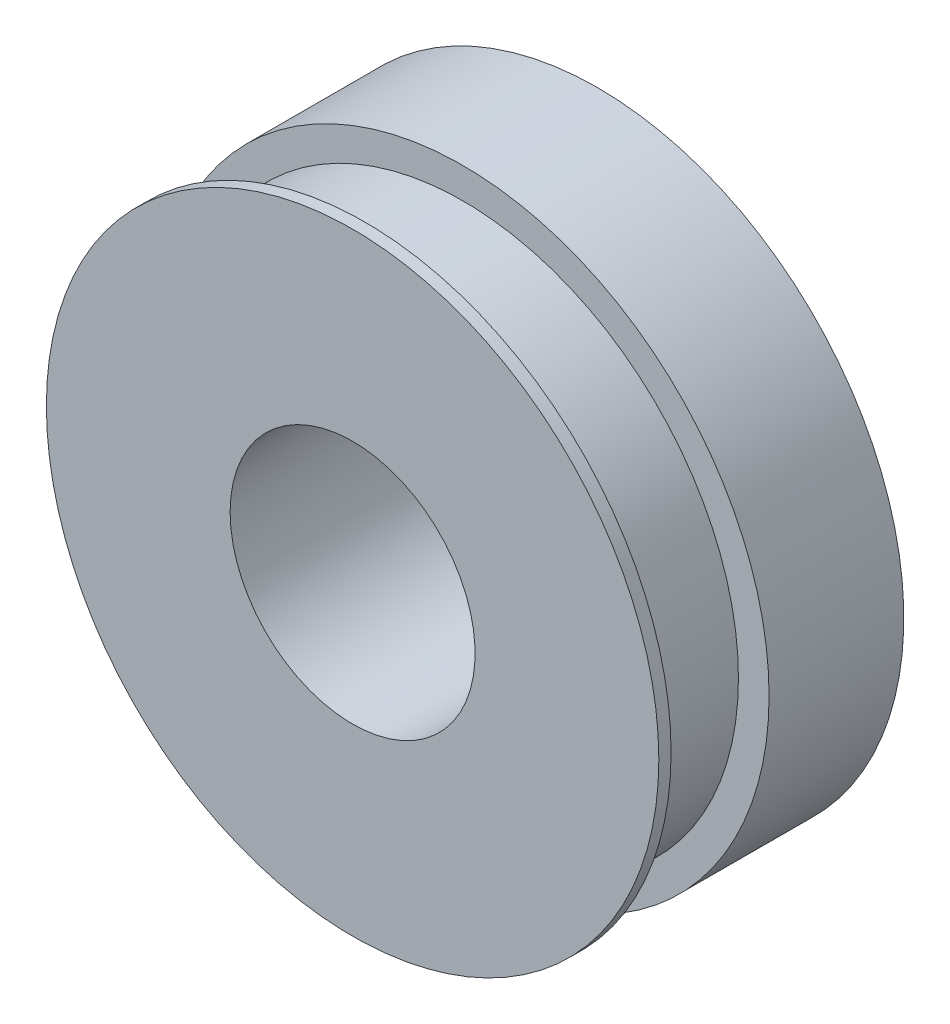
from build123d import *

# Parameters (mm, degrees)
SKETCH1_R           = 25
BOSS_EXTRUDE1_DEPTH = 20
SKETCH2_R           = 5
BOSS_EXTRUDE2_DEPTH = 10
SKETCH3_R           = 10
CUT_EXTRUDE1_DEPTH  = 41.620192023
CUT_EXTRUDE2_START  = -9
SKETCH5_R           = 25
SKETCH5_R_2         = 22.5
CUT_EXTRUDE2_DEPTH  = 8


with BuildPart() as part:
    # Sketch1 → Boss-Extrude1 (new body)
    with BuildSketch(Plane.XY):
        Circle(SKETCH1_R)
    extrude(amount=BOSS_EXTRUDE1_DEPTH)

    # Sketch2 → Boss-Extrude2 (add)
    with BuildSketch(Plane(origin=(0, 0, 0), x_dir=(-1, 0, 0), z_dir=(0, 0, -1))):
        with Locations(Location((0, -20, 0), (0, 0, 270))):
            Circle(SKETCH2_R)
    extrude(amount=BOSS_EXTRUDE2_DEPTH)

    # Sketch3 → Cut-Extrude1 (cut, through all)
    with BuildSketch(Plane(origin=(0, 0, 0), x_dir=(-1, 0, 0), z_dir=(0, 0, -1))):
        Circle(SKETCH3_R)
    extrude(amount=-CUT_EXTRUDE1_DEPTH, mode=Mode.SUBTRACT)

    # Sketch5 → Cut-Extrude2 (cut)
    with BuildSketch(Plane.XY.offset(20).offset(CUT_EXTRUDE2_START)):
        with Locations(Location((0, 0, 0), (0, 0, 270))):
            Circle(SKETCH5_R)
        Circle(SKETCH5_R_2, mode=Mode.SUBTRACT)
    extrude(amount=CUT_EXTRUDE2_DEPTH, mode=Mode.SUBTRACT)


solid = part.part
